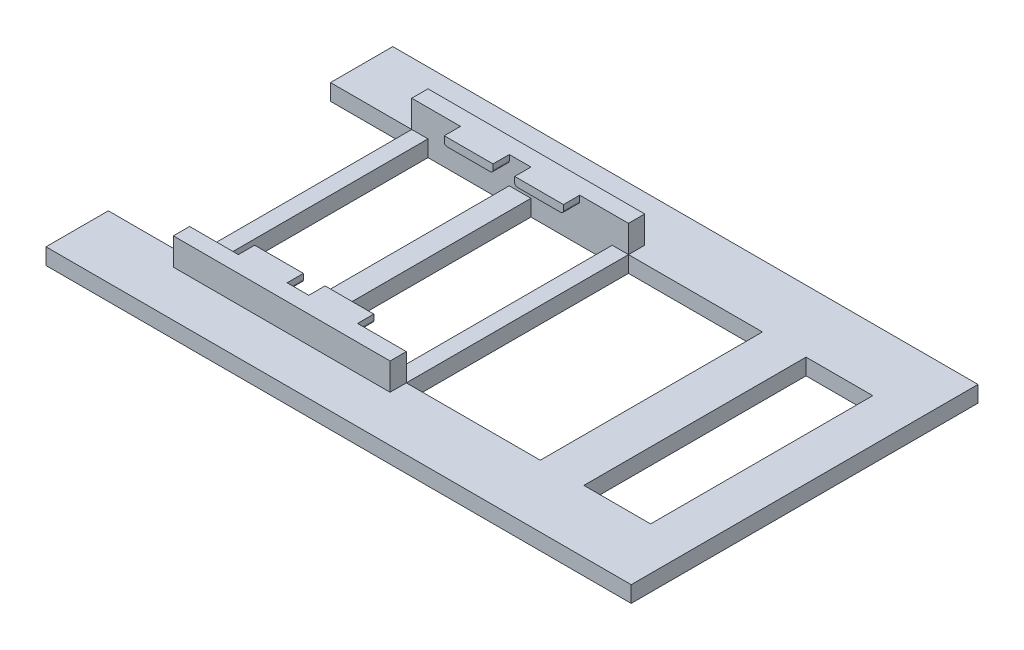
from build123d import *

# Parameters (mm, degrees)
CROQUIS1_W              = 40
CROQUIS1_H              = 47
CROQUIS1_W_2            = 15
CROQUIS1_H_2            = 41
SALIENTE_EXTRUIR1_DEPTH = 3
CROQUIS3_W              = 40
CROQUIS3_H              = 3
SALIENTE_EXTRUIR2_DEPTH = 5
SALIENTE_EXTRUIR3_DEPTH = 3
CROQUIS6_W              = 40
CROQUIS6_H              = 3
SALIENTE_EXTRUIR4_DEPTH = 8.5
CROQUIS7_W              = 11.5
CROQUIS7_H              = 3
SALIENTE_EXTRUIR5_DEPTH = 15
CROQUIS8_W              = 64.003791446
CROQUIS8_H              = 3
SALIENTE_EXTRUIR7_DEPTH = 53
CROQUIS9_W              = 24.723137679
CROQUIS9_H              = 41
CROQUIS9_W_2            = 12.312971116
CORTAR_EXTRUIR1_DEPTH   = 53


with BuildPart() as part:
    # Croquis1 → Saliente-Extruir1 (new body)
    with BuildSketch(Plane(origin=(0, 0, 0), x_dir=(1, 0, 0), z_dir=(0, 1, 0))):
        Rectangle(CROQUIS1_W, CROQUIS1_H)
        with Locations((-9.5, 0)):
            Rectangle(CROQUIS1_W_2, CROQUIS1_H_2, mode=Mode.SUBTRACT)
        with Locations((9.5, 0)):
            Rectangle(CROQUIS1_W_2, CROQUIS1_H_2, mode=Mode.SUBTRACT)
    extrude(amount=SALIENTE_EXTRUIR1_DEPTH)

    # Croquis3 → Saliente-Extruir2 (add)
    with BuildSketch(Plane(origin=(0, 3, 0), x_dir=(1, 0, 0), z_dir=(0, 1, 0))):
        with Locations((0, 22)):
            Rectangle(CROQUIS3_W, CROQUIS3_H)
        with Locations((0, -22)):
            Rectangle(CROQUIS3_W, CROQUIS3_H)
    extrude(amount=SALIENTE_EXTRUIR2_DEPTH)

    # Croquis5 → Saliente-Extruir3 (add)
    with BuildSketch(Plane.XY.offset(-20.5)):
        with BuildLine():
            Line((-10.5, 6.5), (-2.5, 6.5))
            ThreePointArc((-2.5, 6.5), (-2.146446609, 6.646446609), (-2, 7))
            Line((-2, 7), (-2, 8))
            Line((-2, 8), (-11, 8))
            Line((-11, 8), (-11, 7))
            ThreePointArc((-11, 7), (-10.853553391, 6.646446609), (-10.5, 6.5))
        make_face()
        with BuildLine():
            Line((2, 7), (2, 8))
            Line((2, 8), (11, 8))
            Line((11, 8), (11, 7))
            ThreePointArc((11, 7), (10.853553391, 6.646446609), (10.5, 6.5))
            Line((10.5, 6.5), (2.5, 6.5))
            ThreePointArc((2.5, 6.5), (2.146446609, 6.646446609), (2, 7))
        make_face()
    saliente_extruir3 = extrude(amount=SALIENTE_EXTRUIR3_DEPTH)

    # Simetría3: Saliente-Extruir3 across plane
    add(saliente_extruir3.mirror(Plane.XY))

    # Croquis6 → Saliente-Extruir4 (add)
    with BuildSketch(Plane.XY.offset(23.5)):
        with Locations((0, 1.5)):
            Rectangle(CROQUIS6_W, CROQUIS6_H)
    saliente_extruir4 = extrude(amount=SALIENTE_EXTRUIR4_DEPTH)

    # Simetría4: Saliente-Extruir4 across plane
    add(saliente_extruir4.mirror(Plane.XY))

    # Croquis7 → Saliente-Extruir5 (add)
    with BuildSketch(Plane.ZY.offset(20)):
        with Locations((-26.25, 1.5)):
            Rectangle(CROQUIS7_W, CROQUIS7_H)
        with Locations((26.25, 1.5)):
            Rectangle(CROQUIS7_W, CROQUIS7_H)
    extrude(amount=SALIENTE_EXTRUIR5_DEPTH)

    # Croquis8 → Saliente-Extruir7 (add)
    with BuildSketch(Plane(origin=(20, 0, 0), x_dir=(0, 0, -1), z_dir=(1, 0, 0))):
        with Locations((0.001895723, 1.5)):
            Rectangle(CROQUIS8_W, CROQUIS8_H)
    extrude(amount=SALIENTE_EXTRUIR7_DEPTH)

    # Croquis9 → Cortar-Extruir1 (cut)
    with BuildSketch(Plane(origin=(0, 3, 0), x_dir=(1, 0, 0), z_dir=(0, 1, 0))):
        with Locations((32.36156884, 0)):
            Rectangle(CROQUIS9_W, CROQUIS9_H)
        with Locations((58.925723175, 0)):
            Rectangle(CROQUIS9_W_2, CROQUIS9_H)
    extrude(amount=-CORTAR_EXTRUIR1_DEPTH, mode=Mode.SUBTRACT)


solid = part.part
